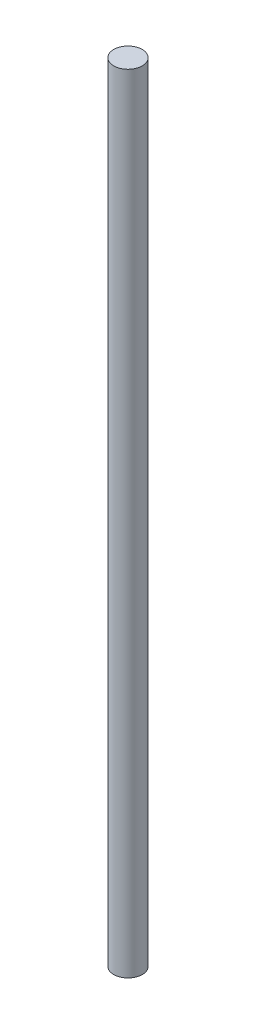
from build123d import *

# Parameters (mm, degrees)
SKETCH1_R           = 1.5875
BOSS_EXTRUDE1_DEPTH = 87.63


with BuildPart() as part:
    # Sketch1 → Boss-Extrude1 (new body)
    with BuildSketch(Plane(origin=(0, 0, 0), x_dir=(1, 0, 0), z_dir=(0, 1, 0))):
        with Locations(Location((0, 0, 0), (0, 0, 270))):
            Circle(SKETCH1_R)
    extrude(amount=BOSS_EXTRUDE1_DEPTH)


solid = part.part
